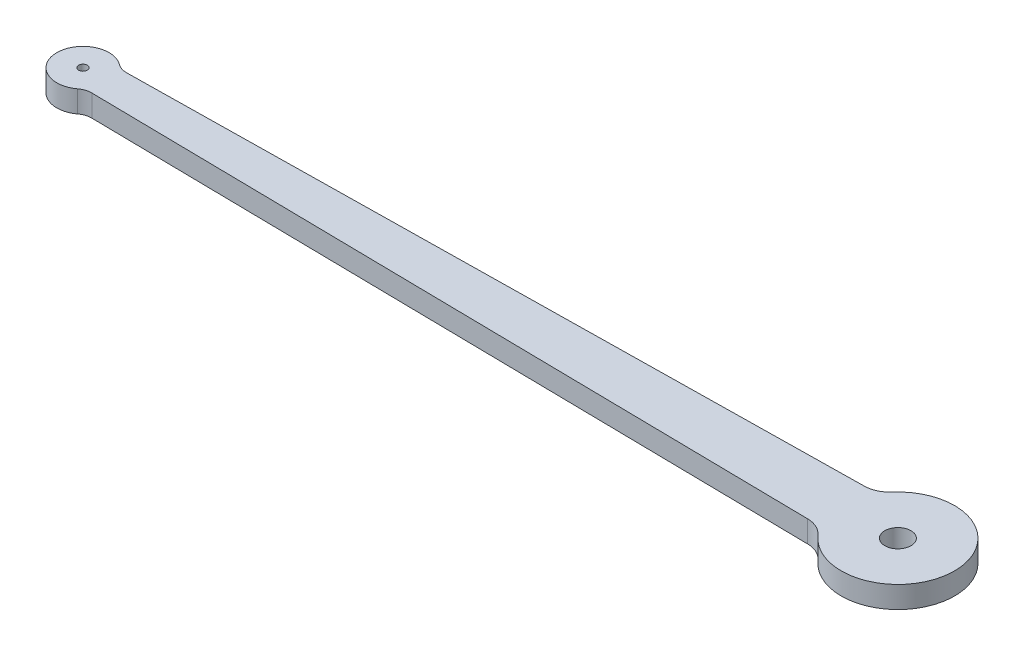
from build123d import *

# Parameters (mm, degrees)
BOSS_EXTRUDE1_DEPTH = 2.5
CUT_EXTRUDE1_REACH  = 55.703
SKETCH2_R           = 0.5
SKETCH2_R_2         = 1.5


with BuildPart() as part:
    # Sketch1 → Boss-Extrude1 (new body)
    with BuildSketch(Plane(origin=(0, 0, 0), x_dir=(1, 0, 0), z_dir=(0, 1, 0))):
        with BuildLine():
            Line((39.640142036, 3.25), (-43.719713181, 2))
            ThreePointArc((-43.719713181, 2), (-44.367984766, 2.097743563), (-44.949820159, 2.399865109))
            ThreePointArc((-44.949820159, 2.399865109), (-49.75, 0), (-44.949820159, -2.399865109))
            ThreePointArc((-44.949820159, -2.399865109), (-44.367984766, -2.097743563), (-43.719713181, -2))
            Line((-43.719713181, -2), (39.640142036, -3.25))
            ThreePointArc((39.640142036, -3.25), (40.856423208, -3.52767477), (41.854584123, -4.276085054))
            ThreePointArc((41.854584123, -4.276085054), (53.25, 0), (41.854584123, 4.276085054))
            ThreePointArc((41.854584123, 4.276085054), (40.856423208, 3.52767477), (39.640142036, 3.25))
        make_face()
    extrude(amount=BOSS_EXTRUDE1_DEPTH)

    # Sketch2 → Cut-Extrude1 (cut, up to next)
    with BuildSketch(Plane(origin=(0, 2.5, 0), x_dir=(1, 0, 0), z_dir=(0, 1, 0)), mode=Mode.PRIVATE) as cut_extrude1_sk1:
        with Locations(Location((-46.75, 0, 0), (0, 0, 270))):
            Circle(SKETCH2_R)
    cut_extrude1_tool1 = extrude(cut_extrude1_sk1.sketch, amount=-CUT_EXTRUDE1_REACH, mode=Mode.PRIVATE) & part.part
    # Sketch2 → Cut-Extrude1 (cut, up to next)
    with BuildSketch(Plane(origin=(0, 2.5, 0), x_dir=(1, 0, 0), z_dir=(0, 1, 0)), mode=Mode.PRIVATE) as cut_extrude1_sk2:
        with Locations(Location((46.75, 0, 0), (0, 0, 270))):
            Circle(SKETCH2_R_2)
    cut_extrude1_tool2 = extrude(cut_extrude1_sk2.sketch, amount=-CUT_EXTRUDE1_REACH, mode=Mode.PRIVATE) & part.part
    add(cut_extrude1_tool1.solids().sort_by_distance((-46.75, 2.5, 0))[0], mode=Mode.SUBTRACT)
    add(cut_extrude1_tool2.solids().sort_by_distance((46.75, 2.5, 0))[0], mode=Mode.SUBTRACT)


solid = part.part
